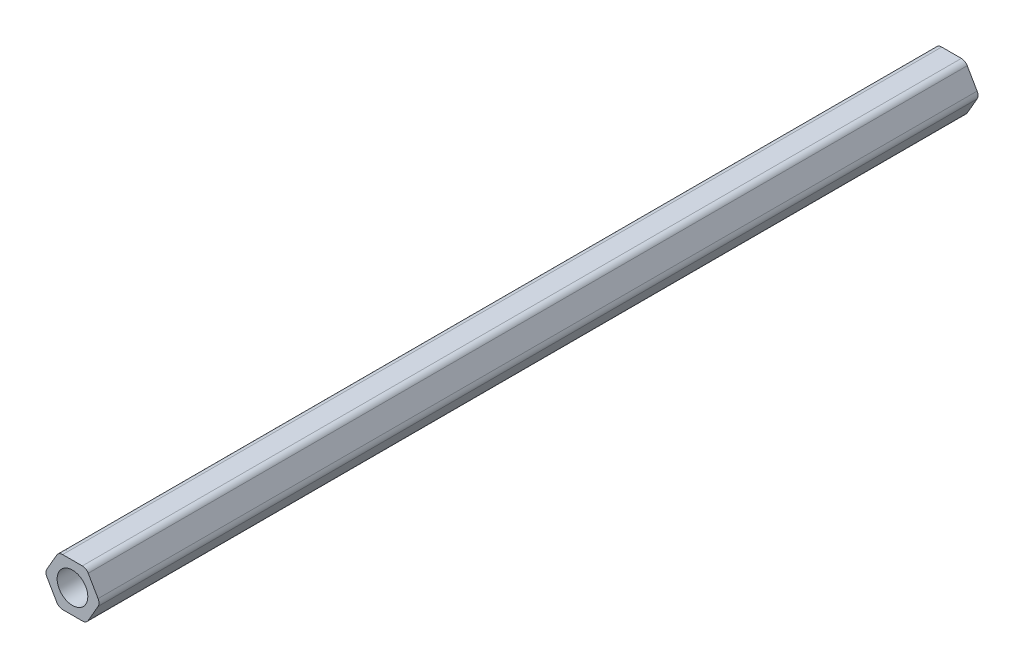
from build123d import *

# Parameters (mm, degrees)
EXTRUDE_1_DEPTH     = 129
SKETCH_2_R          = 2.25
CUT_EXTRUDE_1_DEPTH = 6
CUT_EXTRUDE_START   = -6
SKETCH_3_R          = 2.25
CUT_EXTRUDE_2_DEPTH = 6


with BuildPart() as part:
    # Эскиз1 → Бобышка-Вытянуть1 (new body)
    with BuildSketch(Plane.XY):
        with BuildLine():
            Line((3.75277675, 0.5), (2.309401077, 3))
            ThreePointArc((2.309401077, 3), (1.943375673, 3.366025404), (1.443375673, 3.5))
            Line((1.443375673, 3.5), (-1.443375673, 3.5))
            ThreePointArc((-1.443375673, 3.5), (-1.943375673, 3.366025404), (-2.309401077, 3))
            Line((-2.309401077, 3), (-3.75277675, 0.5))
            ThreePointArc((-3.75277675, 0.5), (-3.886751346, 0), (-3.75277675, -0.5))
            Line((-3.75277675, -0.5), (-2.309401077, -3))
            ThreePointArc((-2.309401077, -3), (-1.943375673, -3.366025404), (-1.443375673, -3.5))
            Line((-1.443375673, -3.5), (1.443375673, -3.5))
            ThreePointArc((1.443375673, -3.5), (1.943375673, -3.366025404), (2.309401077, -3))
            Line((2.309401077, -3), (3.75277675, -0.5))
            ThreePointArc((3.75277675, -0.5), (3.886751346, 0), (3.75277675, 0.5))
        make_face()
    extrude(amount=EXTRUDE_1_DEPTH)

    # Эскиз2 → Вырез-Вытянуть1 (cut)
    with BuildSketch(Plane.XY.offset(129)):
        Circle(SKETCH_2_R)
    extrude(amount=-CUT_EXTRUDE_1_DEPTH, mode=Mode.SUBTRACT)

    # Эскиз3 → Вырез-Вытянуть2 (cut)
    with BuildSketch(Plane(origin=(0, 0, 0), x_dir=(-1, 0, 0), z_dir=(0, 0, -1)).offset(CUT_EXTRUDE_START)):
        with Locations(Location((0, 0, 0), (0, 0, 180))):
            Circle(SKETCH_3_R)
    extrude(amount=CUT_EXTRUDE_2_DEPTH, mode=Mode.SUBTRACT)


solid = part.part
